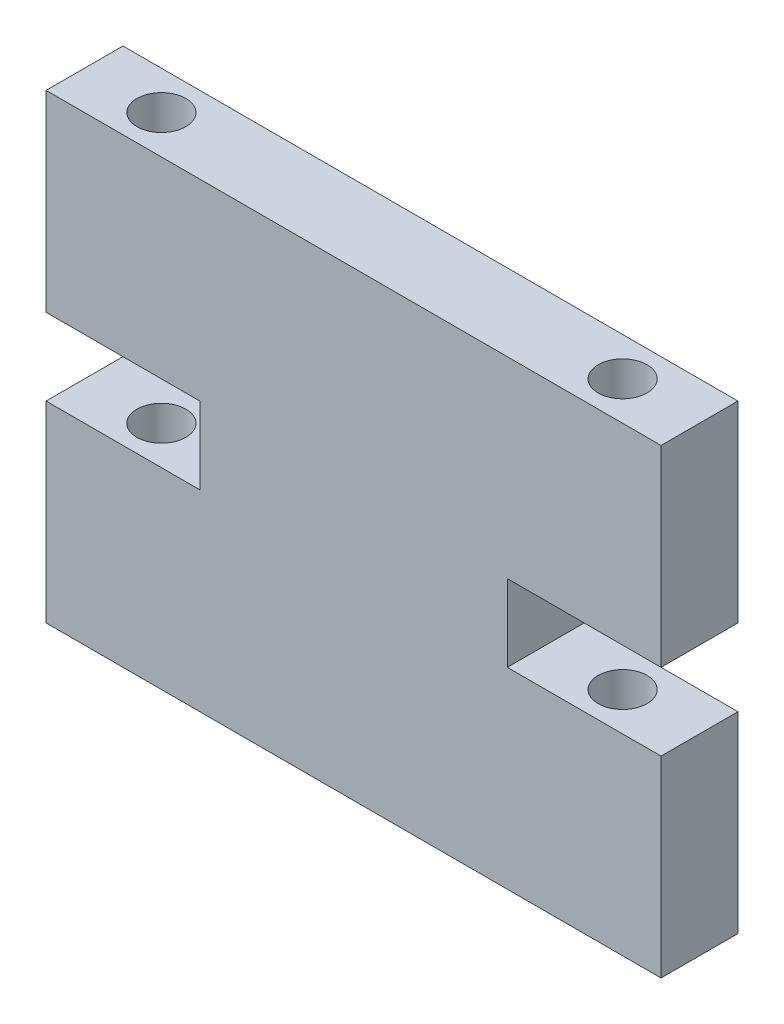
from build123d import *

# Parameters (mm, degrees)
BOSS_EXTRUDE1_DEPTH = 5
SKETCH2_R           = 1.591812525
CUT_EXTRUDE1_DEPTH  = 37.400549446


with BuildPart() as part:
    # Sketch1 → Boss-Extrude1 (new body)
    with BuildSketch(Plane.XY):
        Polygon((-15, 15), (15, 15), (20, 15), (20, 2.5), (10, 2.5), (10, -2.5), (20, -2.5), (20, -15), (15, -15), (-15, -15), (-20, -15), (-20, -2.5), (-10, -2.5), (-10, 2.5), (-20, 2.5), (-20, 15), align=None)
    extrude(amount=BOSS_EXTRUDE1_DEPTH)

    # Sketch2 → Cut-Extrude1 (cut, through all)
    with BuildSketch(Plane(origin=(0, 15, 0), x_dir=(1, 0, 0), z_dir=(0, 1, 0))):
        with Locations(Location((-15, -2.5, 0), (0, 0, 180))):
            Circle(SKETCH2_R)
    cut_extrude1 = extrude(amount=-CUT_EXTRUDE1_DEPTH, mode=Mode.SUBTRACT)

    # Mirror1: Cut-Extrude1 across plane
    add(cut_extrude1.mirror(Plane(origin=(0, 0, 0), x_dir=(0, 0, 1), z_dir=(1, 0, 0))), mode=Mode.SUBTRACT)


solid = part.part
